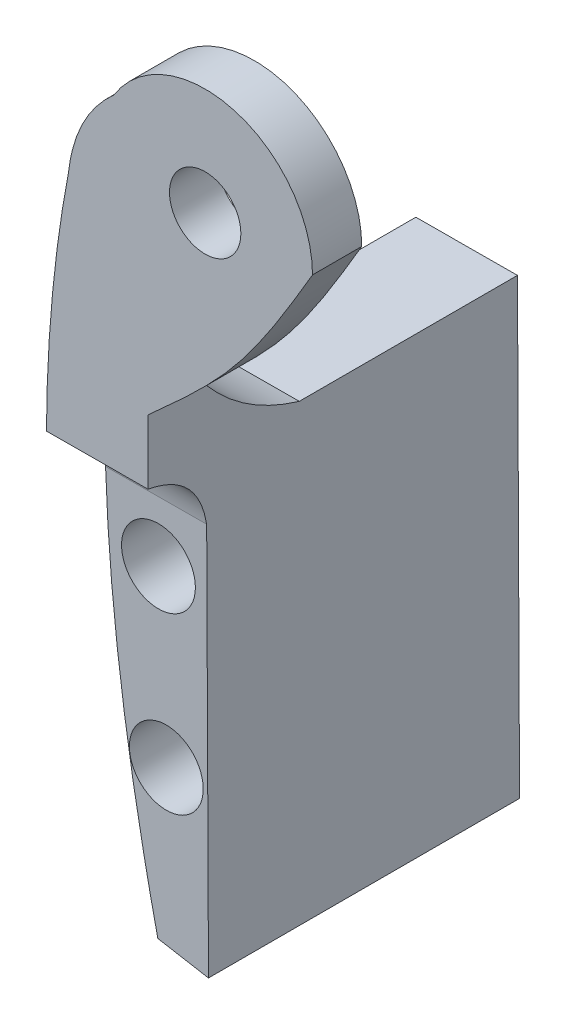
from build123d import *

# Parameters (mm, degrees)
SKETCH1_R           = 2.9
BOSS_EXTRUDE1_DEPTH = 4
BOSS_EXTRUDE2_DEPTH = 26.012432
SKETCH3_R           = 1.75
CUT_EXTRUDE1_DEPTH  = 79.761768867
BOSS_EXTRUDE5_DEPTH = 8.258541
CUT_EXTRUDE2_DEPTH  = 78.706037614
SKETCH6_R           = 3
CUT_EXTRUDE3_DEPTH  = 10


with BuildPart() as part:
    # Sketch1 → Boss-Extrude1 (new body)
    with BuildSketch(Plane.XY):
        with BuildLine():
            Line((-14.153385189, -69.716871134), (-10.039841479, -70.438427685))
            Line((-10.039841479, -70.438427685), (-10.231600818, -28.548135162))
            add(Edge.make_bspline(
                [(3.150526507, -12), (1.121426745, -15.448537633), (-2.522354698, -21.641292501), (-7.864373324, -26.42729642), (-10.231600818, -28.548135162)],
                knots=[0, 0, 0, 0, 0.556866484, 1, 1, 1, 1], degree=3))
            ThreePointArc((3.150526507, -12), (-3.18362895, -3.611112101), (-12.986183722, -7.406488955))
            add(Edge.make_bspline(
                [(-16.663916234, -14.630806425), (-16.157795835, -10.23676377), (-12.986183722, -7.406488955)],
                knots=[0, 0, 0, 1, 1, 1], degree=2))
            add(Edge.make_bspline(
                [(-16.663916234, -14.630806425), (-17.667702323, -19.881251045), (-18.220131563, -25.189037493), (-18.401311599, -30.514562532)],
                knots=[0, 0, 0, 0, 0.288118642, 0.288118642, 0.288118642, 0.288118642], degree=3))
            add(Edge.make_bspline(
                [(-18.401311599, -30.514562532), (-18.848969857, -43.672829442), (-17.03022033, -56.93938717), (-14.153385189, -69.716871134)],
                knots=[0.288118642, 0.288118642, 0.288118642, 0.288118642, 1, 1, 1, 1], degree=3))
        make_face()
        with Locations((-5.571628032, -12)):
            Circle(SKETCH1_R, mode=Mode.SUBTRACT)
    extrude(amount=-BOSS_EXTRUDE1_DEPTH)

    # Sketch2 → Boss-Extrude2 (add)
    with BuildSketch(Plane(origin=(0, 0, -4), x_dir=(-1, 0, 0), z_dir=(0, 0, -1))):
        with BuildLine():
            Line((10.207939206, -33.717071631), (18.466393507, -33.754875992))
            add(Edge.make_bspline(
                [(14.153385189, -69.716871134), (16.794208846, -57.987633874), (18.543433317, -45.846277061), (18.466393507, -33.754875992)],
                knots=[0.288118642, 0.288118642, 0.288118642, 0.288118642, 0.941598261, 0.941598261, 0.941598261, 0.941598261], degree=3))
            Line((14.153385189, -69.716871134), (10.039841479, -70.438427685))
            Line((10.039841479, -70.438427685), (10.207939206, -33.717071631))
        make_face()
    extrude(amount=BOSS_EXTRUDE2_DEPTH)

    # Sketch3 → Cut-Extrude1 (cut, through all)
    with BuildSketch(Plane.XY):
        with Locations((-14.103208948, -43.496863521)):
            Circle(SKETCH3_R)
        with Locations((-13.466819568, -57.346536005)):
            Circle(SKETCH3_R)
    extrude(amount=-CUT_EXTRUDE1_DEPTH, mode=Mode.SUBTRACT)

    # Sketch4 → Boss-Extrude5 (add)
    with BuildSketch(Plane(origin=(-10.362067217, -0.047433977, 0), x_dir=(0, 0, -1), z_dir=(0.9999895226985053, 0.004577607804942551, 0))):
        with BuildLine():
            Line((4, -27.831413473), (2.736644913, -37.390501041))
            Line((2.736644913, -37.390501041), (12.284980679, -33.669990424))
            add(Edge.make_bspline(
                [(4, -27.831413473), (7.157671382, -32.153592381), (12.284980679, -33.669990424)],
                knots=[0, 0, 0, 1, 1, 1], degree=2))
        make_face()
    extrude(amount=-BOSS_EXTRUDE5_DEPTH)

    # Sketch5 → Cut-Extrude2 (cut, through all)
    with BuildSketch(Plane(origin=(-10.362067217, -0.047433977, 0), x_dir=(0, 0, -1), z_dir=(0.9999895226985053, 0.004577607804942551, 0))):
        with BuildLine():
            Line((4.737663573, -38.538106349), (4.737663573, -70.391731224))
            Line((4.737663573, -70.391731224), (0, -70.391731224))
            Line((0, -70.391731224), (0, -33.715344655))
            add(Edge.make_bspline(
                [(0, -33.715344655), (4.079743683, -34.458317421), (4.737663573, -38.538106349)],
                knots=[0, 0, 0, 1, 1, 1], degree=2))
        make_face()
    extrude(amount=-CUT_EXTRUDE2_DEPTH, mode=Mode.SUBTRACT)

    # Sketch6 → Cut-Extrude3 (cut)
    with BuildSketch(Plane.XY.offset(-4.737663573)):
        with Locations((-13.466819568, -57.346536005)):
            Circle(SKETCH6_R)
        with Locations((-14.103208948, -43.496863521)):
            Circle(SKETCH6_R)
    extrude(amount=-CUT_EXTRUDE3_DEPTH, mode=Mode.SUBTRACT)


solid = part.part
